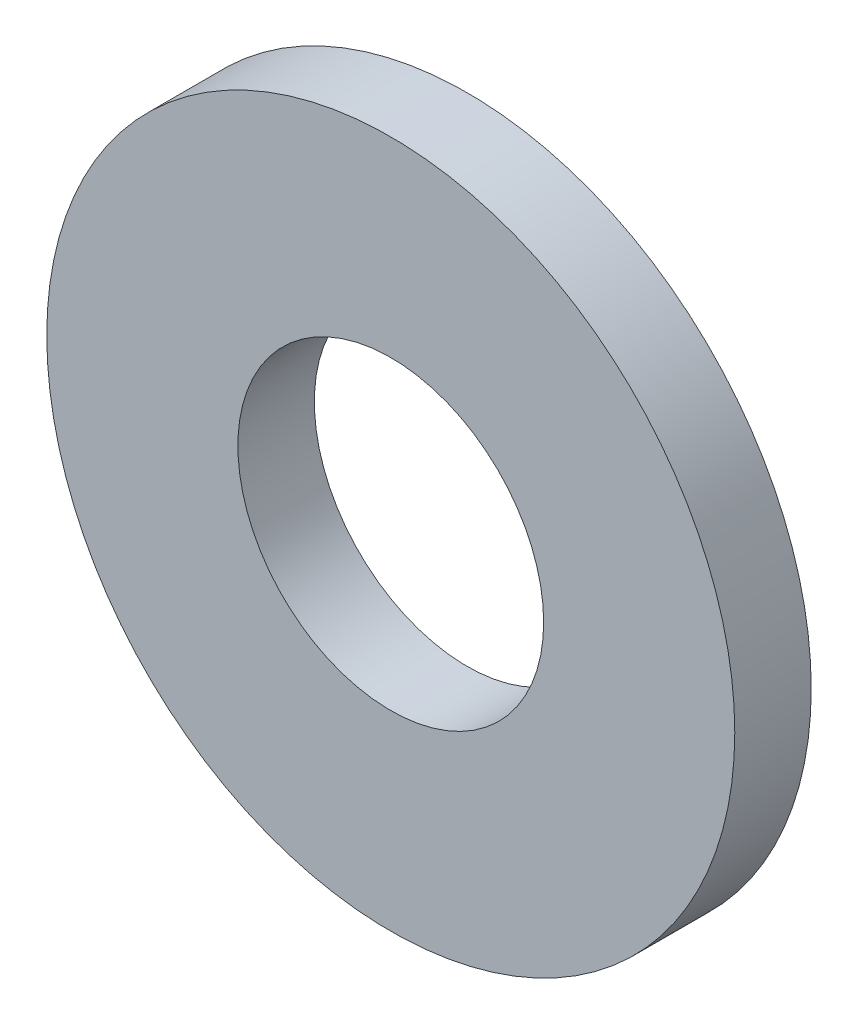
from build123d import *

# Parameters (mm, degrees)
SKETCH_1_R      = 4.5
SKETCH_1_R_2    = 2
EXTRUDE_1_DEPTH = 1


with BuildPart() as part:
    # 草图1 → 凸台-拉伸1 (new body)
    with BuildSketch(Plane.XY):
        Circle(SKETCH_1_R)
        Circle(SKETCH_1_R_2, mode=Mode.SUBTRACT)
    extrude(amount=EXTRUDE_1_DEPTH)


solid = part.part
